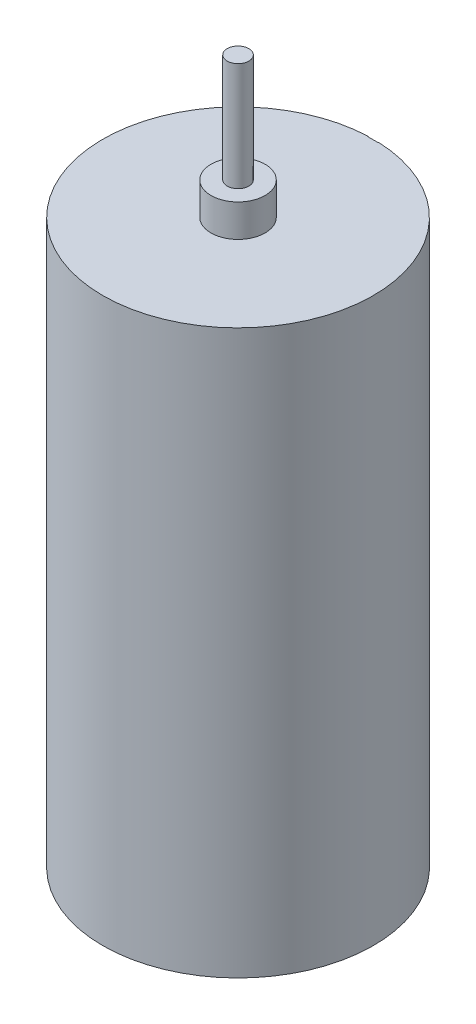
from build123d import *

# Parameters (mm, degrees)
CROQUIS1_R              = 12.5
SALIENTE_EXTRUIR1_DEPTH = 52
CROQUIS2_R              = 2.5
SALIENTE_EXTRUIR2_DEPTH = 3
CROQUIS3_R              = 1
SALIENTE_EXTRUIR3_DEPTH = 10
CROQUIS4_W              = 0.1
CROQUIS4_H              = 0.1
CORTAR_EXTRUIR1_DEPTH   = 0.1
CROQUIS5_W              = 1
CROQUIS5_H              = 0.1
CORTAR_EXTRUIR2_DEPTH   = 45


with BuildPart() as part:
    # Croquis1 → Saliente-Extruir1 (new body)
    with BuildSketch(Plane(origin=(0, 0, 0), x_dir=(1, 0, 0), z_dir=(0, 1, 0))):
        with Locations(Location((0, 0, 0), (0, 0, 90))):
            Circle(CROQUIS1_R)
    extrude(amount=SALIENTE_EXTRUIR1_DEPTH)

    # Croquis2 → Saliente-Extruir2 (add)
    with BuildSketch(Plane(origin=(0, 52, 0), x_dir=(1, 0, 0), z_dir=(0, 1, 0))):
        with Locations(Location((0, 0, 0), (0, 0, 270))):
            Circle(CROQUIS2_R)
    extrude(amount=SALIENTE_EXTRUIR2_DEPTH)

    # Croquis3 → Saliente-Extruir3 (add)
    with BuildSketch(Plane(origin=(0, 55, 0), x_dir=(1, 0, 0), z_dir=(0, 1, 0))):
        with Locations(Location((0, 0, 0), (0, 0, 270))):
            Circle(CROQUIS3_R)
    extrude(amount=SALIENTE_EXTRUIR3_DEPTH)

    # Croquis4 → Cortar-Extruir1 (cut)
    with BuildSketch(Plane(origin=(0, 52, 0), x_dir=(1, 0, 0), z_dir=(0, 1, 0))):
        with Locations((0, 12.5)):
            Rectangle(CROQUIS4_W, CROQUIS4_H)
    extrude(amount=-CORTAR_EXTRUIR1_DEPTH, mode=Mode.SUBTRACT)

    # Croquis5 → Cortar-Extruir2 (cut)
    with BuildSketch(Plane(origin=(0, 52, 0), x_dir=(1, 0, 0), z_dir=(0, 1, 0))):
        with Locations((0, 12.5)):
            Rectangle(CROQUIS5_W, CROQUIS5_H)
    extrude(amount=-CORTAR_EXTRUIR2_DEPTH, mode=Mode.SUBTRACT)


solid = part.part
